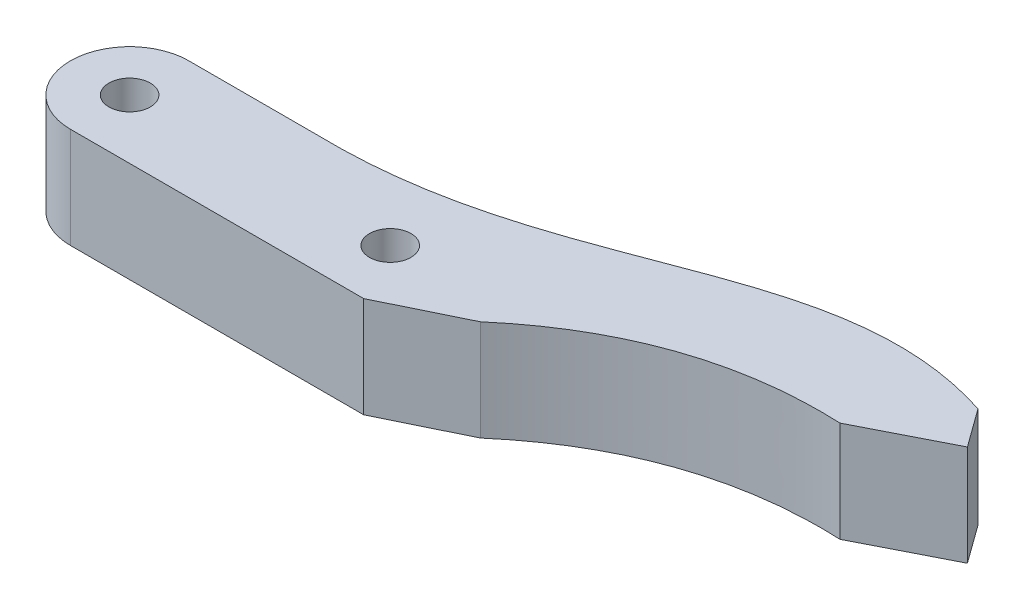
from build123d import *

# Parameters (mm, degrees)
SKETCH2_R           = 5
SKETCH2_R_2         = 1.75
BOSS_EXTRUDE1_DEPTH = 8.5
BOSS_EXTRUDE2_START = -8.5
BOSS_EXTRUDE2_DEPTH = 8.5


with BuildPart() as part:
    # Sketch2 → Boss-Extrude1 (new body)
    # profile 1 of 3: a face of its own
    with BuildSketch(Plane(origin=(0, 0, 0), x_dir=(1, 0, 0), z_dir=(0, 1, 0))):
        Circle(SKETCH2_R)
        with Locations(Location((0, 0, 0), (0, 0, 270))):
            Circle(SKETCH2_R_2, mode=Mode.SUBTRACT)
    # profile 2 of 3: a face of its own
    with BuildSketch(Plane(origin=(0, 0, 0), x_dir=(1, 0, 0), z_dir=(0, 1, 0))):
        with BuildLine():
            Line((22, 5), (0, 5))
            ThreePointArc((0, 5), (3.535533906, 3.535533906), (5, 0))
            ThreePointArc((5, 0), (3.535533906, -3.535533906), (0, -5))
            Line((0, -5), (22, -5))
            ThreePointArc((22, -5), (17, 0), (22, 5))
        make_face()
    # profile 3 of 3: a face of its own
    with BuildSketch(Plane(origin=(0, 0, 0), x_dir=(1, 0, 0), z_dir=(0, 1, 0))):
        with Locations((22, 0)):
            Circle(SKETCH2_R)
        with Locations(Location((22, 0, 0), (0, 0, 270))):
            Circle(SKETCH2_R_2, mode=Mode.SUBTRACT)
    extrude(amount=BOSS_EXTRUDE1_DEPTH)

    # Sketch3 → Boss-Extrude2 (add)
    with BuildSketch(Plane(origin=(0, 8.5, 0), x_dir=(1, 0, 0), z_dir=(0, 1, 0)).offset(BOSS_EXTRUDE2_START)):
        with BuildLine():
            ThreePointArc((22, 5), (27, 0), (22, -5))
            Line((22, -5), (24.765014751, -5))
            Line((24.765014751, -5), (31.381419164, -1.772963949))
            add(Edge.make_bspline(
                [(31.381419164, -1.772963949), (41.129259451, 6.582699459), (53.966862985, 6)],
                knots=[0, 0, 0, 1, 1, 1], degree=2))
            Line((53.966862985, 6), (61.095847858, 9.630092929))
            Line((61.095847858, 9.630092929), (58.75, 12.87))
            add(Edge.make_bspline(
                [(12.956629398, 5), (32.247892428, 5.420652932), (42.340471259, 18.148408487), (58.75, 12.87)],
                knots=[0.03219955, 0.03219955, 0.03219955, 0.03219955, 1, 1, 1, 1], degree=3))
            Line((12.956629398, 5), (22, 5))
        make_face()
    extrude(amount=BOSS_EXTRUDE2_DEPTH)


solid = part.part
